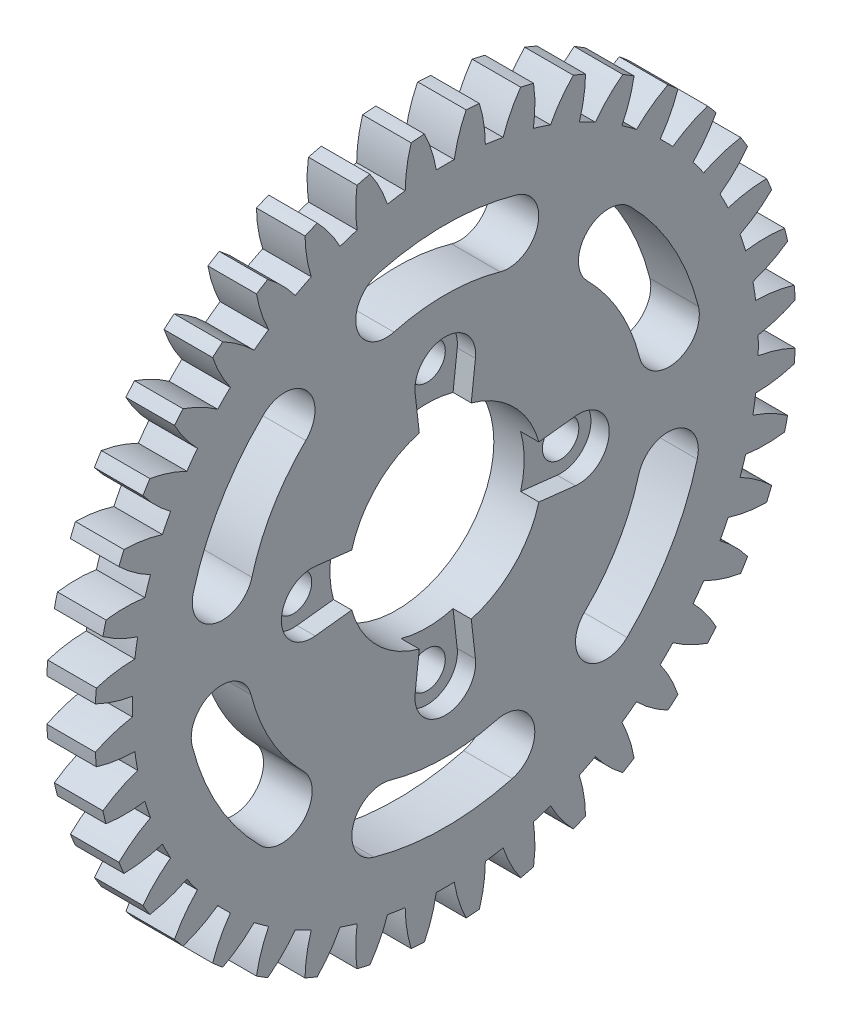
from build123d import *

# Parameters (mm, degrees)
BASPROSKE_W         = 4
BASPROSKE_H         = 28.875
TOOTHCUT_DEPTH      = 42.030857291
TEETHCUTS_COUNT     = 40
TEETHCUTS_ANGLE     = 351
BORSKE_R            = 8
BORE_DEPTH          = 50.0000508
SKETCH_1_R          = 1.5
CUT_EXTRUDE_2_DEPTH = 1.5
SKETCH_3_R          = 1.5
CUT_EXTRUDE_3_DEPTH = 41.958614085


with BuildPart() as part:
    # BasProSke → Base-Revolve (revolve)
    with BuildSketch(Plane(origin=(0, 0, 0), x_dir=(1, 0, 0), z_dir=(0, 1, 0)), mode=Mode.PRIVATE) as base_revolve_sk:
        with Locations((2, 14.4375)):
            Rectangle(BASPROSKE_W, BASPROSKE_H)
    revolve(base_revolve_sk.sketch.rotate(Axis((-10, 0, 0), (1, 0, 0)), 180), axis=Axis((-10, 0, 0), (1, 0, 0)))

    # TooCutSke → ToothCut (cut, through all)
    with BuildSketch(Plane(origin=(0, 0, 0), x_dir=(0, 0, -1), z_dir=(1, 0, 0))):
        with BuildLine():
            ThreePointArc((0.73985828, 25.769631348), (0, 25.78025), (-0.73985828, 25.769631348))
            ThreePointArc((-0.73985828, 25.769631348), (-1.12269264, 27.345722393), (-1.733123409, 28.848386496))
            ThreePointArc((-1.733123409, 28.848386496), (0, 28.9004), (1.733123409, 28.848386496))
            ThreePointArc((1.733123409, 28.848386496), (1.12269264, 27.345722393), (0.73985828, 25.769631348))
        make_face()
    toothcut = extrude(amount=TOOTHCUT_DEPTH, mode=Mode.SUBTRACT)

    # TeethCuts: ToothCut ×40 about axis
    teethcuts_axis = Axis((-10, 0, 0), (1, 0, 0))
    for i in range(1, TEETHCUTS_COUNT):
        add(toothcut.rotate(teethcuts_axis, i * TEETHCUTS_ANGLE / (TEETHCUTS_COUNT - 1)), mode=Mode.SUBTRACT)

    # BorSke → Bore (cut, symmetric)
    with BuildSketch(Plane(origin=(0, 0, 0), x_dir=(0, 0, -1), z_dir=(1, 0, 0))):
        with Locations(Location((0, 0, 0), (0, 0, 180))):
            Circle(BORSKE_R)
    extrude(amount=BORE_DEPTH, both=True, mode=Mode.SUBTRACT)

    # 草图1 → 切除-拉伸2 (cut)
    # profile 1 of 13: a face of its own
    with BuildSketch(Plane(origin=(4, 0, 0), x_dir=(0, 0, -1), z_dir=(1, 0, 0))):
        with Locations((11, 0)):
            Circle(SKETCH_1_R)
    # profile 2 of 13: a face of its own
    with BuildSketch(Plane(origin=(4, 0, 0), x_dir=(0, 0, -1), z_dir=(1, 0, 0))):
        with BuildLine():
            ThreePointArc((10.715909091, -2.483806022), (11, 0), (10.715909091, 2.483806022))
            ThreePointArc((10.715909091, 2.483806022), (13.5, 0), (10.715909091, -2.483806022))
        make_face()
    # profile 3 of 13: a face of its own
    with BuildSketch(Plane(origin=(4, 0, 0), x_dir=(0, 0, -1), z_dir=(1, 0, 0))):
        with BuildLine():
            ThreePointArc((12.5, 0), (12.023863006, 1.096222854), (10.897727273, 1.496509368))
            ThreePointArc((10.897727273, 1.496509368), (11, 0), (10.897727273, -1.496509368))
            ThreePointArc((10.897727273, -1.496509368), (12.023863006, -1.096222854), (12.5, 0))
        make_face()
    # profile 4 of 13: a face of its own
    with BuildSketch(Plane(origin=(4, 0, 0), x_dir=(0, 0, -1), z_dir=(1, 0, 0))):
        with BuildLine():
            ThreePointArc((10.897727273, -1.496509368), (11, 0), (10.897727273, 1.496509368))
            ThreePointArc((10.897727273, 1.496509368), (9.5, 0), (10.897727273, -1.496509368))
        make_face()
    # profile 5 of 13: a face of its own
    with BuildSketch(Plane(origin=(4, 0, 0), x_dir=(0, 0, -1), z_dir=(1, 0, 0))):
        with BuildLine():
            ThreePointArc((12.5, 0), (12.023863006, 1.096222854), (10.897727273, 1.496509368))
            ThreePointArc((10.897727273, 1.496509368), (11, 0), (10.897727273, -1.496509368))
            ThreePointArc((10.897727273, -1.496509368), (12.023863006, -1.096222854), (12.5, 0))
        make_face()
    # profile 6 of 13: a face of its own
    with BuildSketch(Plane(origin=(4, 0, 0), x_dir=(0, 0, -1), z_dir=(1, 0, 0))):
        with BuildLine():
            ThreePointArc((10.897727273, -1.496509368), (11, 0), (10.897727273, 1.496509368))
            ThreePointArc((10.897727273, 1.496509368), (9.5, 0), (10.897727273, -1.496509368))
        make_face()
    # profile 7 of 13: a face of its own
    with BuildSketch(Plane(origin=(4, 0, 0), x_dir=(0, 0, -1), z_dir=(1, 0, 0))):
        with BuildLine():
            ThreePointArc((10.897727273, 1.496509368), (10.818087071, 1.992232947), (10.715909091, 2.483806022))
            Line((10.715909091, 2.483806022), (7.708510617, 2.139828047))
            ThreePointArc((7.708510617, 2.139828047), (7.926792697, 1.079795135), (8, 0))
            ThreePointArc((8, 0), (7.926792697, -1.079795135), (7.708510617, -2.139828047))
            Line((7.708510617, -2.139828047), (10.715909091, -2.483806022))
            ThreePointArc((10.715909091, -2.483806022), (10.818087071, -1.992232947), (10.897727273, -1.496509368))
            ThreePointArc((10.897727273, -1.496509368), (9.5, 0), (10.897727273, 1.496509368))
        make_face()
    # profile 8 of 13: a face of its own
    with BuildSketch(Plane(origin=(4, 0, 0), x_dir=(0, 0, -1), z_dir=(1, 0, 0))):
        with BuildLine():
            Line((2.483806022, -10.715909091), (2.139828047, -7.708510617))
            ThreePointArc((2.139828047, -7.708510617), (0, -8), (-2.139828047, -7.708510617))
            Line((-2.139828047, -7.708510617), (-2.483806022, -10.715909091))
            ThreePointArc((-2.483806022, -10.715909091), (0, -13.5), (2.483806022, -10.715909091))
        make_face()
        with Locations((0, -11)):
            Circle(SKETCH_1_R, mode=Mode.SUBTRACT)
    # profile 9 of 13: a face of its own
    with BuildSketch(Plane(origin=(4, 0, 0), x_dir=(0, 0, -1), z_dir=(1, 0, 0))):
        with Locations((0, -11)):
            Circle(SKETCH_1_R)
    # profile 10 of 13: a face of its own
    with BuildSketch(Plane(origin=(4, 0, 0), x_dir=(0, 0, -1), z_dir=(1, 0, 0))):
        with BuildLine():
            ThreePointArc((-7.708510617, -2.139828047), (-8, 0), (-7.708510617, 2.139828047))
            Line((-7.708510617, 2.139828047), (-10.715909091, 2.483806022))
            ThreePointArc((-10.715909091, 2.483806022), (-13.5, 0), (-10.715909091, -2.483806022))
            Line((-10.715909091, -2.483806022), (-7.708510617, -2.139828047))
        make_face()
        with Locations((-11, 0)):
            Circle(SKETCH_1_R, mode=Mode.SUBTRACT)
    # profile 11 of 13: a face of its own
    with BuildSketch(Plane(origin=(4, 0, 0), x_dir=(0, 0, -1), z_dir=(1, 0, 0))):
        with Locations((-11, 0)):
            Circle(SKETCH_1_R)
    # profile 12 of 13: a face of its own
    with BuildSketch(Plane(origin=(4, 0, 0), x_dir=(0, 0, -1), z_dir=(1, 0, 0))):
        with BuildLine():
            ThreePointArc((-2.139828047, 7.708510617), (0, 8), (2.139828047, 7.708510617))
            Line((2.139828047, 7.708510617), (2.483806022, 10.715909091))
            ThreePointArc((2.483806022, 10.715909091), (0, 13.5), (-2.483806022, 10.715909091))
            Line((-2.483806022, 10.715909091), (-2.139828047, 7.708510617))
        make_face()
        with Locations((0, 11)):
            Circle(SKETCH_1_R, mode=Mode.SUBTRACT)
    # profile 13 of 13: a face of its own
    with BuildSketch(Plane(origin=(4, 0, 0), x_dir=(0, 0, -1), z_dir=(1, 0, 0))):
        with Locations((0, 11)):
            Circle(SKETCH_1_R)
    extrude(amount=-CUT_EXTRUDE_2_DEPTH, mode=Mode.SUBTRACT)

    # 草图3 → 切除-拉伸3 (cut, through all)
    with BuildSketch(Plane(origin=(4, 0, 0), x_dir=(0, 0, -1), z_dir=(1, 0, 0))):
        with Locations((11, 0)):
            Circle(SKETCH_3_R)
        with BuildLine():
            ThreePointArc((20.849850751, 5.247258682), (18.713417191, 10.585745936), (15.238451278, 15.167056493))
            ThreePointArc((15.238451278, 15.167056493), (11.702927118, 15.175358212), (11.694625399, 11.639834053))
            ThreePointArc((11.694625399, 11.639834053), (14.361459705, 8.123944556), (16.00104825, 4.026965965))
            ThreePointArc((16.00104825, 4.026965965), (19.035595859, 2.212711074), (20.849850751, 5.247258682))
        make_face()
        with BuildLine():
            ThreePointArc((11.487978952, -11.843831289), (11.434061931, -15.378954053), (14.969184694, -15.432871074))
            ThreePointArc((14.969184694, -15.432871074), (18.524233494, -10.913421711), (20.754281862, -5.613357675))
            ThreePointArc((20.754281862, -5.613357675), (18.993709282, -2.547353077), (15.927704685, -4.307925657))
            ThreePointArc((15.927704685, -4.307925657), (14.216272217, -8.375416662), (11.487978952, -11.843831289))
        make_face()
        with BuildLine():
            ThreePointArc((4.513069299, 15.870797255), (7.601533928, 17.591665127), (5.880666056, 20.680129756))
            ThreePointArc((5.880666056, 20.680129756), (0.189183697, 21.499167647), (-5.515830584, 20.780414167))
            ThreePointArc((-5.515830584, 20.780414167), (-7.290782164, 17.722711289), (-4.233079286, 15.94775971))
            ThreePointArc((-4.233079286, 15.94775971), (0.145187488, 16.499361218), (4.513069299, 15.870797255))
        make_face()
        with Locations((0, 11)):
            Circle(SKETCH_3_R)
        with BuildLine():
            ThreePointArc((-4.513069299, -15.870797255), (-7.601533928, -17.591665127), (-5.880666056, -20.680129756))
            ThreePointArc((-5.880666056, -20.680129756), (-0.189183697, -21.499167647), (5.515830584, -20.780414167))
            ThreePointArc((5.515830584, -20.780414167), (7.290782164, -17.722711289), (4.233079286, -15.94775971))
            ThreePointArc((4.233079286, -15.94775971), (-0.145187488, -16.499361218), (-4.513069299, -15.870797255))
        make_face()
        with Locations((0, -11)):
            Circle(SKETCH_3_R)
        with Locations((-11, 0)):
            Circle(SKETCH_3_R)
        with BuildLine():
            ThreePointArc((-11.487978952, 11.843831289), (-11.434061931, 15.378954053), (-14.969184694, 15.432871074))
            ThreePointArc((-14.969184694, 15.432871074), (-18.524233494, 10.913421711), (-20.754281862, 5.613357675))
            ThreePointArc((-20.754281862, 5.613357675), (-18.993709282, 2.547353077), (-15.927704685, 4.307925657))
            ThreePointArc((-15.927704685, 4.307925657), (-14.216272217, 8.375416662), (-11.487978952, 11.843831289))
        make_face()
        with BuildLine():
            ThreePointArc((-16.00104825, -4.026965965), (-19.035595859, -2.212711074), (-20.849850751, -5.247258682))
            ThreePointArc((-20.849850751, -5.247258682), (-18.713417191, -10.585745936), (-15.238451278, -15.167056493))
            ThreePointArc((-15.238451278, -15.167056493), (-11.702927118, -15.175358212), (-11.694625399, -11.639834053))
            ThreePointArc((-11.694625399, -11.639834053), (-14.361459705, -8.123944556), (-16.00104825, -4.026965965))
        make_face()
    extrude(amount=-CUT_EXTRUDE_3_DEPTH, mode=Mode.SUBTRACT)


solid = part.part
